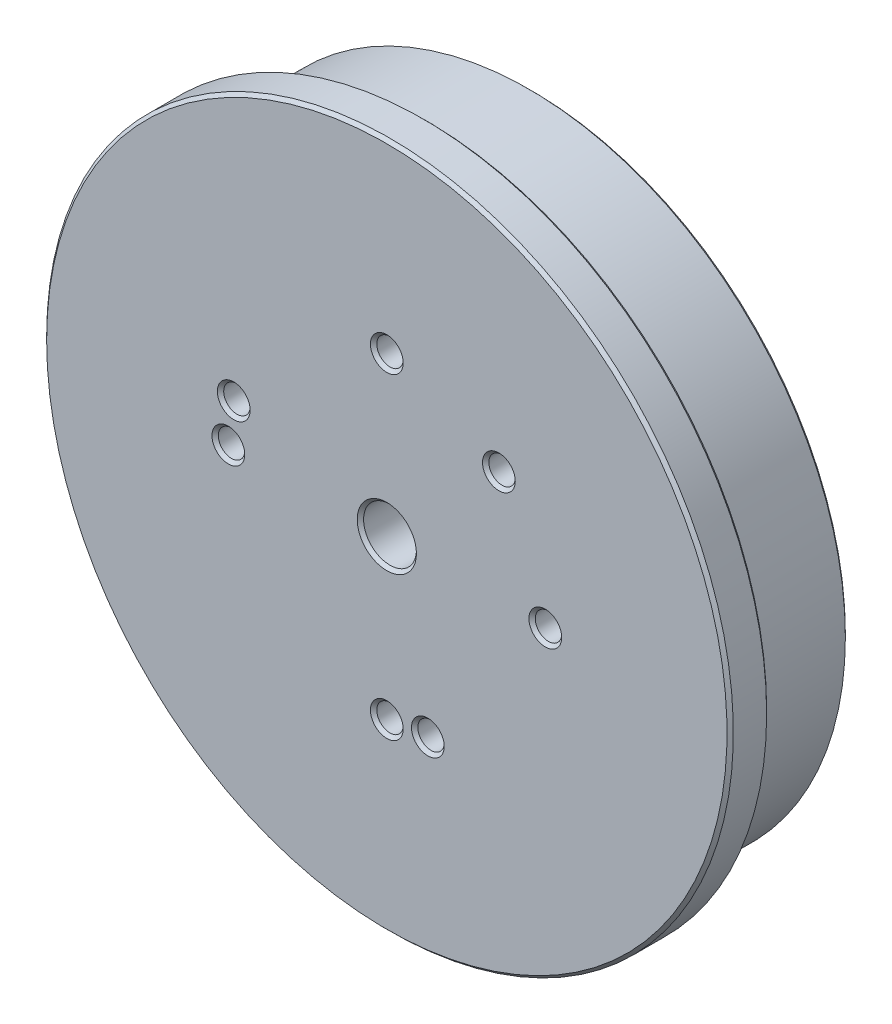
from build123d import *

# Parameters (mm, degrees)
SKETCH1_R           = 76.073
BOSS_EXTRUDE1_DEPTH = 25.4
SKETCH2_R           = 82.55
BOSS_EXTRUDE2_DEPTH = 9.525
SKETCH3_R           = 3.175
CUT_EXTRUDE1_DEPTH  = 122.855490746
SKETCH5_R           = 6.35
CUT_EXTRUDE2_DEPTH  = 122.855490746
CHAMFER1_SIZE       = 0.762


with BuildPart() as part:
    # Sketch1 → Boss-Extrude1 (new body)
    with BuildSketch(Plane.XY):
        Circle(SKETCH1_R)
    extrude(amount=BOSS_EXTRUDE1_DEPTH)

    # Sketch2 → Boss-Extrude2 (add)
    with BuildSketch(Plane.XY.offset(25.4)):
        with Locations(Location((0, 0, 0), (0, 0, 180))):
            Circle(SKETCH2_R)
    extrude(amount=BOSS_EXTRUDE2_DEPTH)

    # Sketch3 → Cut-Extrude1 (cut, through all)
    with BuildSketch(Plane.XY.offset(34.925)):
        with Locations((0, 38.1)):
            Circle(SKETCH3_R)
        with Locations((26.940768363, 26.940768363)):
            Circle(SKETCH3_R)
        with Locations((38.1, 0)):
            Circle(SKETCH3_R)
        with Locations((9.861005618, -36.801773982)):
            Circle(SKETCH3_R)
        with Locations((0, -38.1)):
            Circle(SKETCH3_R)
        with Locations((-38.1, 0)):
            Circle(SKETCH3_R)
        with Locations((-36.801773982, 9.861005618)):
            Circle(SKETCH3_R)
    extrude(amount=-CUT_EXTRUDE1_DEPTH, mode=Mode.SUBTRACT)

    # Sketch5 → Cut-Extrude2 (cut, through all)
    with BuildSketch(Plane.XY.offset(34.925)):
        Circle(SKETCH5_R)
    extrude(amount=-CUT_EXTRUDE2_DEPTH, mode=Mode.SUBTRACT)

    # Chamfer1
    chamfer1_edges = [part.edges().sort_by_distance(p)[0] for p in [
        (-76.073, 0, 0),
        (-39.976773982, 9.861005618, 0),
        (-39.976773982, 9.861005618, 34.925),
        (-41.275, 0, 0),
        (-41.275, 0, 34.925),
        (-3.175, -38.1, 0),
        (-3.175, -38.1, 34.925),
        (6.686005618, -36.801773982, 0),
        (6.686005618, -36.801773982, 34.925),
        (-3.175, 38.1, 0),
        (-3.175, 38.1, 34.925),
        (34.925, 0, 0),
        (34.925, 0, 34.925),
        (23.765768363, 26.940768363, 0),
        (23.765768363, 26.940768363, 34.925),
        (-6.35, 0, 0),
        (-6.35, 0, 34.925),
        (82.55, 0, 25.4),
        (82.55, 0, 34.925),
    ]]
    chamfer(chamfer1_edges, length=CHAMFER1_SIZE)


solid = part.part
